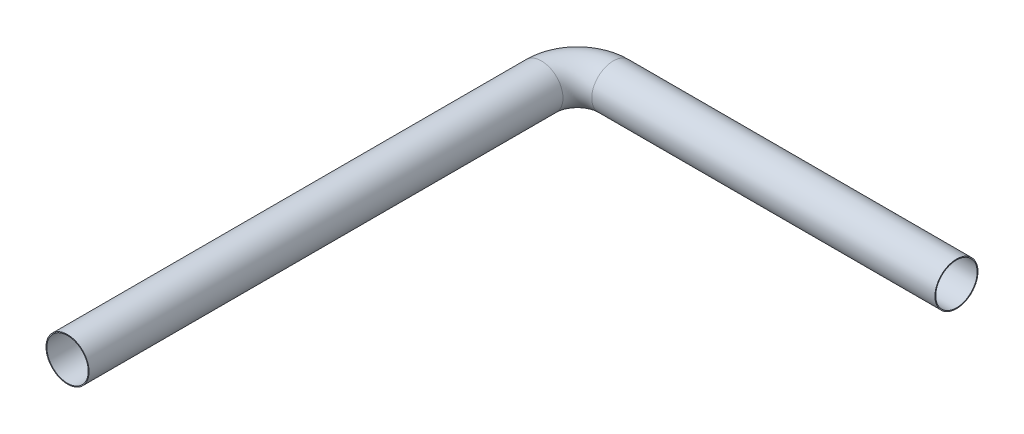
from build123d import *

# Parameters (mm, degrees)
SKETCH1_R   = 30
SKETCH1_R_2 = 28.8


with BuildPart() as part:
    # Sweep1: sweep along a path in Sketch2
    with BuildLine(Plane(origin=(0, 0, 0), x_dir=(1, 0, 0), z_dir=(0, 1, 0))) as sweep1_path:
        Line((0, 0), (0, 660))
        ThreePointArc((0, 660), (14.644660941, 695.355339059), (50, 710))
        Line((50, 710), (527.958415109, 710))
    # Sketch1 → Sweep1 (sweep)
    with BuildSketch(Plane.XY):
        Circle(SKETCH1_R)
        Circle(SKETCH1_R_2, mode=Mode.SUBTRACT)
    sweep(path=sweep1_path.line)


solid = part.part
